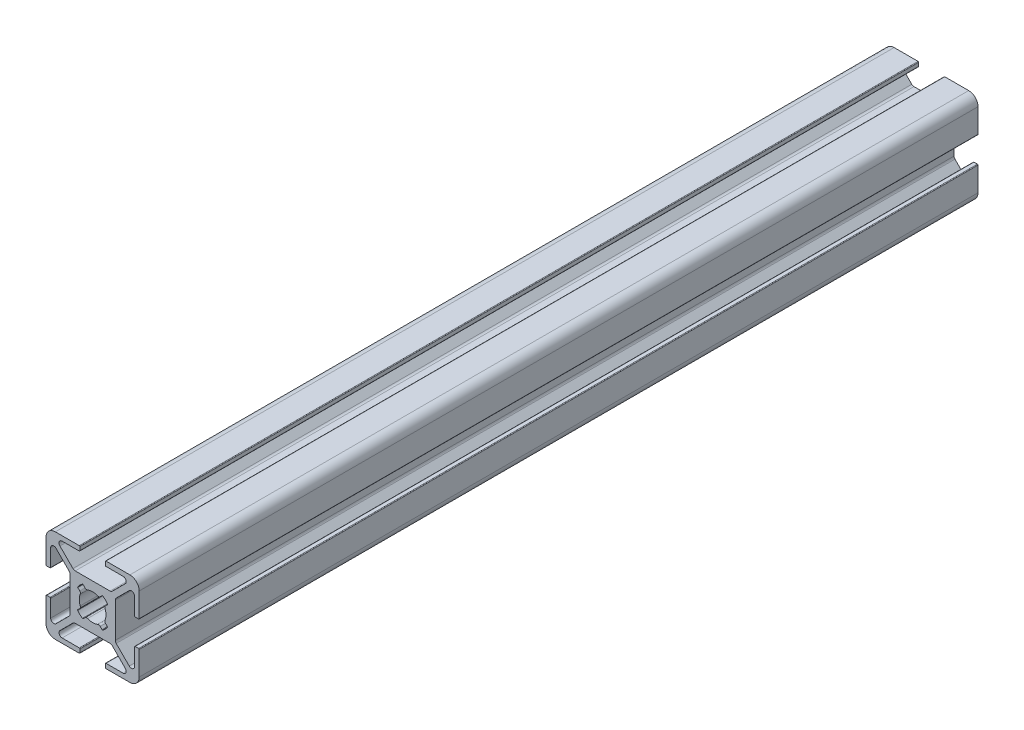
from build123d import *

# Parameters (mm, degrees)
EXTRUDE1_DEPTH = 270


with BuildPart() as part:
    # Sketch1 → Extrude1 (new body)
    with BuildSketch(Plane.XY):
        with BuildLine():
            Line((-12, 15), (-4.3, 15))
            ThreePointArc((-4.3, 15), (-4.158578644, 14.941421356), (-4.1, 14.8))
            Line((-4.1, 14.8), (-4.1, 13.7))
            ThreePointArc((-4.1, 13.7), (-4.158578644, 13.558578644), (-4.3, 13.5))
            Line((-4.3, 13.5), (-9.812994231, 13.5))
            ThreePointArc((-9.812994231, 13.5), (-10.736873764, 12.882683432), (-10.520101013, 11.792893219))
            Line((-10.520101013, 11.792893219), (-6.320101013, 7.592893219))
            ThreePointArc((-6.320101013, 7.592893219), (-5.995677664, 7.376120467), (-5.612994231, 7.3))
            Line((-5.612994231, 7.3), (5.612994231, 7.3))
            ThreePointArc((5.612994231, 7.3), (5.995677664, 7.376120467), (6.320101013, 7.592893219))
            Line((6.320101013, 7.592893219), (10.520101013, 11.792893219))
            ThreePointArc((10.520101013, 11.792893219), (10.736873764, 12.882683432), (9.812994231, 13.5))
            Line((9.812994231, 13.5), (4.3, 13.5))
            ThreePointArc((4.3, 13.5), (4.158578644, 13.558578644), (4.1, 13.7))
            Line((4.1, 13.7), (4.1, 14.8))
            ThreePointArc((4.1, 14.8), (4.158578644, 14.941421356), (4.3, 15))
            Line((4.3, 15), (12, 15))
            ThreePointArc((12, 15), (14.121320344, 14.121320344), (15, 12))
            Line((15, 12), (15, 4.3))
            ThreePointArc((15, 4.3), (14.941421356, 4.158578644), (14.8, 4.1))
            Line((14.8, 4.1), (13.7, 4.1))
            ThreePointArc((13.7, 4.1), (13.558578644, 4.158578644), (13.5, 4.3))
            Line((13.5, 4.3), (13.5, 9.812994231))
            ThreePointArc((13.5, 9.812994231), (12.882683432, 10.736873764), (11.792893219, 10.520101013))
            Line((11.792893219, 10.520101013), (7.592893219, 6.320101013))
            ThreePointArc((7.592893219, 6.320101013), (7.376120467, 5.995677664), (7.3, 5.612994231))
            Line((7.3, 5.612994231), (7.3, -5.612994231))
            ThreePointArc((7.3, -5.612994231), (7.376120467, -5.995677664), (7.592893219, -6.320101013))
            Line((7.592893219, -6.320101013), (11.792893219, -10.520101013))
            ThreePointArc((11.792893219, -10.520101013), (12.882683432, -10.736873764), (13.5, -9.812994231))
            Line((13.5, -9.812994231), (13.5, -4.3))
            ThreePointArc((13.5, -4.3), (13.558578644, -4.158578644), (13.7, -4.1))
            Line((13.7, -4.1), (14.8, -4.1))
            ThreePointArc((14.8, -4.1), (14.941421356, -4.158578644), (15, -4.3))
            Line((15, -4.3), (15, -12))
            ThreePointArc((15, -12), (14.121320344, -14.121320344), (12, -15))
            Line((12, -15), (4.3, -15))
            ThreePointArc((4.3, -15), (4.158578644, -14.941421356), (4.1, -14.8))
            Line((4.1, -14.8), (4.1, -13.7))
            ThreePointArc((4.1, -13.7), (4.158578644, -13.558578644), (4.3, -13.5))
            Line((4.3, -13.5), (9.812994231, -13.5))
            ThreePointArc((9.812994231, -13.5), (10.736873764, -12.882683432), (10.520101013, -11.792893219))
            Line((10.520101013, -11.792893219), (6.320101013, -7.592893219))
            ThreePointArc((6.320101013, -7.592893219), (5.995677664, -7.376120467), (5.612994231, -7.3))
            Line((5.612994231, -7.3), (-5.612994231, -7.3))
            ThreePointArc((-5.612994231, -7.3), (-5.995677664, -7.376120467), (-6.320101013, -7.592893219))
            Line((-6.320101013, -7.592893219), (-10.520101013, -11.792893219))
            ThreePointArc((-10.520101013, -11.792893219), (-10.736873764, -12.882683432), (-9.812994231, -13.5))
            Line((-9.812994231, -13.5), (-4.3, -13.5))
            ThreePointArc((-4.3, -13.5), (-4.158578644, -13.558578644), (-4.1, -13.7))
            Line((-4.1, -13.7), (-4.1, -14.8))
            ThreePointArc((-4.1, -14.8), (-4.158578644, -14.941421356), (-4.3, -15))
            Line((-4.3, -15), (-12, -15))
            ThreePointArc((-12, -15), (-14.121320344, -14.121320344), (-15, -12))
            Line((-15, -12), (-15, -4.3))
            ThreePointArc((-15, -4.3), (-14.941421356, -4.158578644), (-14.8, -4.1))
            Line((-14.8, -4.1), (-13.7, -4.1))
            ThreePointArc((-13.7, -4.1), (-13.558578644, -4.158578644), (-13.5, -4.3))
            Line((-13.5, -4.3), (-13.5, -9.812994231))
            ThreePointArc((-13.5, -9.812994231), (-12.882683432, -10.736873764), (-11.792893219, -10.520101013))
            Line((-11.792893219, -10.520101013), (-7.592893219, -6.320101013))
            ThreePointArc((-7.592893219, -6.320101013), (-7.376120467, -5.995677664), (-7.3, -5.612994231))
            Line((-7.3, -5.612994231), (-7.3, 5.612994231))
            ThreePointArc((-7.3, 5.612994231), (-7.376120467, 5.995677664), (-7.592893219, 6.320101013))
            Line((-7.592893219, 6.320101013), (-11.792893219, 10.520101013))
            ThreePointArc((-11.792893219, 10.520101013), (-12.882683432, 10.736873764), (-13.5, 9.812994231))
            Line((-13.5, 9.812994231), (-13.5, 4.3))
            ThreePointArc((-13.5, 4.3), (-13.558578644, 4.158578644), (-13.7, 4.1))
            Line((-13.7, 4.1), (-14.8, 4.1))
            ThreePointArc((-14.8, 4.1), (-14.941421356, 4.158578644), (-15, 4.3))
            Line((-15, 4.3), (-15, 12))
            ThreePointArc((-15, 12), (-14.121320344, 14.121320344), (-12, 15))
        make_face()
        with BuildLine():
            Line((-3.04762381, 4.744680085), (-2.445405681, 4.142461956))
            ThreePointArc((-2.445405681, 4.142461956), (-2.06276965, 3.937478186), (-1.630658427, 3.978813026))
            ThreePointArc((-1.630658427, 3.978813026), (0, 4.3), (1.630658427, 3.978813026))
            ThreePointArc((1.630658427, 3.978813026), (2.06276965, 3.937478186), (2.445405681, 4.142461956))
            Line((2.445405681, 4.142461956), (3.04762381, 4.744680085))
            ThreePointArc((3.04762381, 4.744680085), (3.171115834, 4.802453455), (3.302939637, 4.767660826))
            ThreePointArc((3.302939637, 4.767660826), (4.101219331, 4.101219331), (4.767660826, 3.302939637))
            ThreePointArc((4.767660826, 3.302939637), (4.802453455, 3.171115834), (4.744680085, 3.04762381))
            Line((4.744680085, 3.04762381), (4.142461956, 2.445405681))
            ThreePointArc((4.142461956, 2.445405681), (3.937478186, 2.06276965), (3.978813026, 1.630658427))
            ThreePointArc((3.978813026, 1.630658427), (4.3, 0), (3.978813026, -1.630658427))
            ThreePointArc((3.978813026, -1.630658427), (3.937478186, -2.06276965), (4.142461956, -2.445405681))
            Line((4.142461956, -2.445405681), (4.744680085, -3.04762381))
            ThreePointArc((4.744680085, -3.04762381), (4.802453455, -3.171115834), (4.767660826, -3.302939637))
            ThreePointArc((4.767660826, -3.302939637), (4.101219331, -4.101219331), (3.302939637, -4.767660826))
            ThreePointArc((3.302939637, -4.767660826), (3.171115834, -4.802453455), (3.04762381, -4.744680085))
            Line((3.04762381, -4.744680085), (2.445405681, -4.142461956))
            ThreePointArc((2.445405681, -4.142461956), (2.06276965, -3.937478186), (1.630658427, -3.978813026))
            ThreePointArc((1.630658427, -3.978813026), (0, -4.3), (-1.630658427, -3.978813026))
            ThreePointArc((-1.630658427, -3.978813026), (-2.06276965, -3.937478186), (-2.445405681, -4.142461956))
            Line((-2.445405681, -4.142461956), (-3.04762381, -4.744680085))
            ThreePointArc((-3.04762381, -4.744680085), (-3.171115834, -4.802453455), (-3.302939637, -4.767660826))
            ThreePointArc((-3.302939637, -4.767660826), (-4.101219331, -4.101219331), (-4.767660826, -3.302939637))
            ThreePointArc((-4.767660826, -3.302939637), (-4.802453455, -3.171115834), (-4.744680085, -3.04762381))
            Line((-4.744680085, -3.04762381), (-4.142461956, -2.445405681))
            ThreePointArc((-4.142461956, -2.445405681), (-3.937478186, -2.06276965), (-3.978813026, -1.630658427))
            ThreePointArc((-3.978813026, -1.630658427), (-4.3, 0), (-3.978813026, 1.630658427))
            ThreePointArc((-3.978813026, 1.630658427), (-3.937478186, 2.06276965), (-4.142461956, 2.445405681))
            Line((-4.142461956, 2.445405681), (-4.744680085, 3.04762381))
            ThreePointArc((-4.744680085, 3.04762381), (-4.802453455, 3.171115834), (-4.767660826, 3.302939637))
            ThreePointArc((-4.767660826, 3.302939637), (-4.101219331, 4.101219331), (-3.302939637, 4.767660826))
            ThreePointArc((-3.302939637, 4.767660826), (-3.171115834, 4.802453455), (-3.04762381, 4.744680085))
        make_face(mode=Mode.SUBTRACT)
    extrude(amount=EXTRUDE1_DEPTH)


solid = part.part
